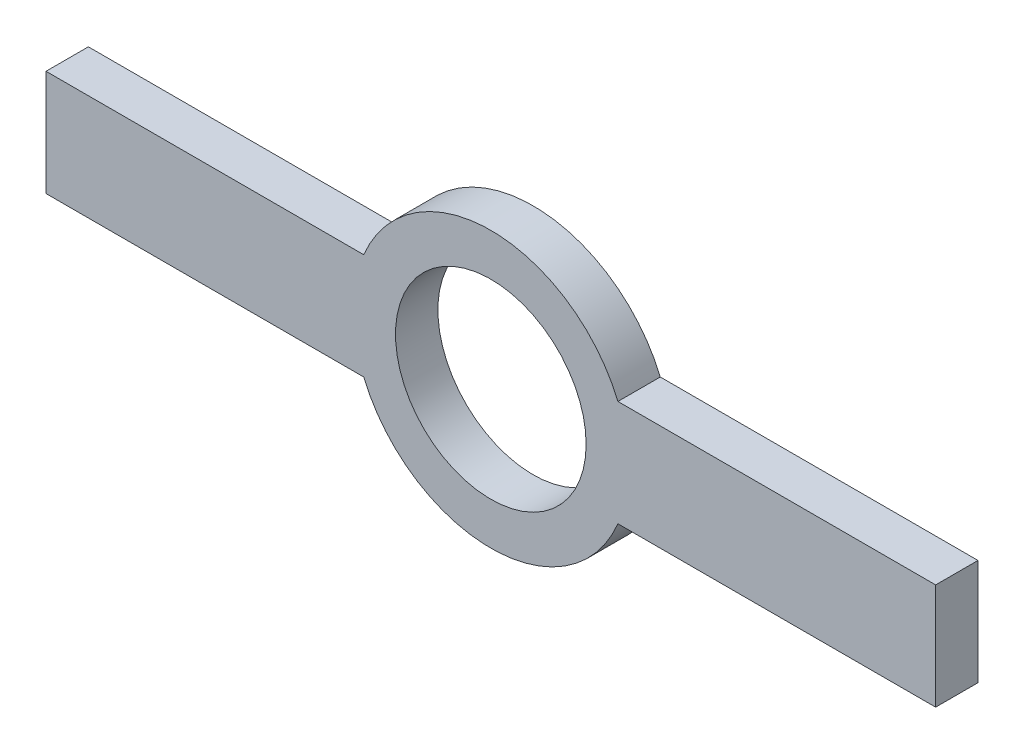
from build123d import *

# Parameters (mm, degrees)
ESTRUSIONE_ESTRUSIONE1_DEPTH = 2
SCHIZZO3_R                   = 4.5
TAGLIO_ESTRUSIONE1_DEPTH     = 2


with BuildPart() as part:
    # Schizzo2 → Estrusione-Estrusione1 (new body)
    with BuildSketch(Plane.XY):
        with BuildLine():
            Line((-21, 2.5), (-21, -2.5))
            Line((-21, -2.5), (-6, -2.5))
            ThreePointArc((-6, -2.5), (-6.5, 0), (-6, 2.5))
            Line((-6, 2.5), (-21, 2.5))
        make_face()
        with BuildLine():
            ThreePointArc((-6, 2.5), (-6.5, 0), (-6, -2.5))
            Line((-6, -2.5), (6, -2.5))
            ThreePointArc((6, -2.5), (6.373774392, -1.274754878), (6.5, 0))
            ThreePointArc((6.5, 0), (6.373774392, 1.274754878), (6, 2.5))
            Line((6, 2.5), (-6, 2.5))
        make_face()
        with BuildLine():
            ThreePointArc((6.5, 0), (6.373774392, -1.274754878), (6, -2.5))
            Line((6, -2.5), (21, -2.5))
            Line((21, -2.5), (21, 2.5))
            Line((21, 2.5), (6, 2.5))
            ThreePointArc((6, 2.5), (6.373774392, 1.274754878), (6.5, 0))
        make_face()
        with BuildLine():
            ThreePointArc((6, 2.5), (0, 6.5), (-6, 2.5))
            Line((-6, 2.5), (6, 2.5))
        make_face()
        with BuildLine():
            Line((6, -2.5), (-6, -2.5))
            ThreePointArc((-6, -2.5), (0, -6.5), (6, -2.5))
        make_face()
    extrude(amount=ESTRUSIONE_ESTRUSIONE1_DEPTH)

    # Schizzo3 → Taglio-Estrusione1 (cut)
    with BuildSketch(Plane.XY.offset(2)):
        Circle(SCHIZZO3_R)
    extrude(amount=-TAGLIO_ESTRUSIONE1_DEPTH, mode=Mode.SUBTRACT)


solid = part.part
